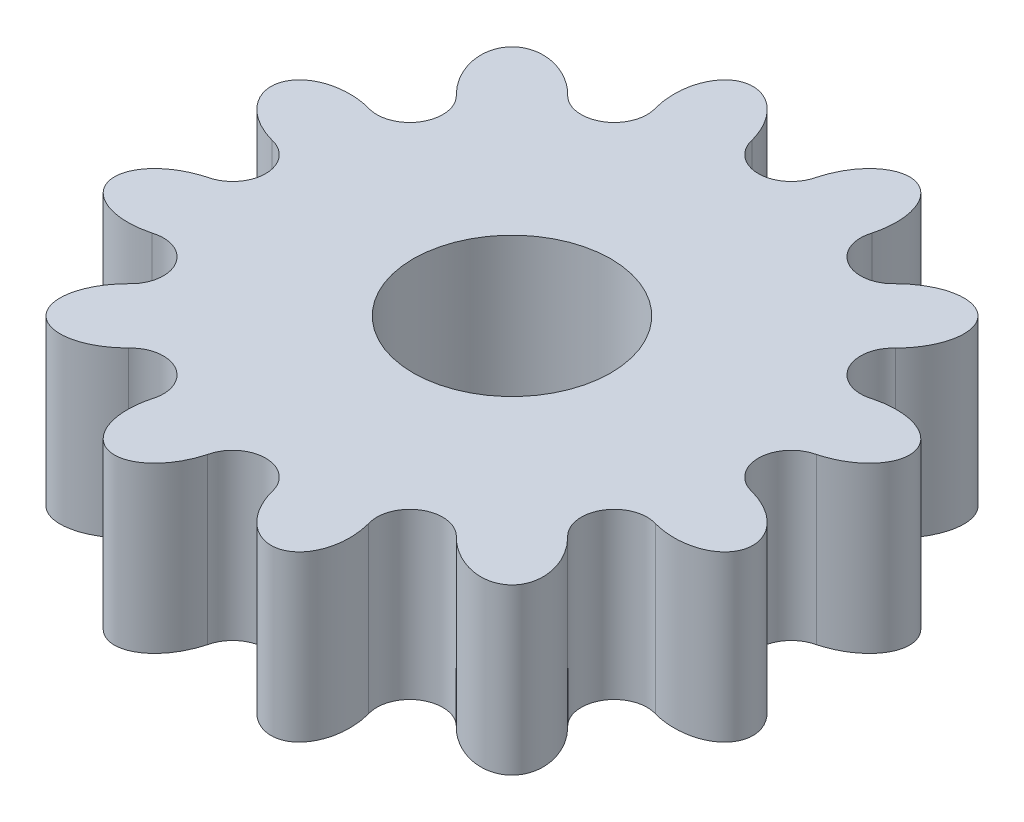
from build123d import *

# Parameters (mm, degrees)
BOSS_EXTRUDE2_DEPTH = 5
SKETCH4_R           = 6
CUT_EXTRUDE3_DEPTH  = 10
CUT_EXTRUDE4_DEPTH  = 10
CIRPATTERN1_COUNT   = 12


with BuildPart() as part:
    # Sketch2 → Boss-Extrude2 (new, symmetric)
    with BuildSketch(Plane(origin=(0, 0, 0), x_dir=(1, 0, 0), z_dir=(0, 1, 0))):
        with BuildLine():
            Line((1.952478146, 16.518952502), (2.684980769, 19.818952502))
            ThreePointArc((2.684980769, 19.818952502), (5.176380902, 19.318516526), (7.584214696, 18.506206728))
            Line((7.584214696, 18.506206728), (6.568580576, 15.282071584))
            ThreePointArc((6.568580576, 15.282071584), (7.476172518, 12.949110648), (9.950371926, 13.329593437))
            Line((9.950371926, 13.329593437), (12.234737806, 15.821225958))
            ThreePointArc((12.234737806, 15.821225958), (14.142135624, 14.142135624), (15.821225958, 12.234737806))
            Line((15.821225958, 12.234737806), (13.329593437, 9.950371926))
            ThreePointArc((13.329593437, 9.950371926), (12.949110648, 7.476172518), (15.282071584, 6.568580576))
            Line((15.282071584, 6.568580576), (18.506206728, 7.584214696))
            ThreePointArc((18.506206728, 7.584214696), (19.318516526, 5.176380902), (19.818952502, 2.684980769))
            Line((19.818952502, 2.684980769), (16.518952502, 1.952478146))
            ThreePointArc((16.518952502, 1.952478146), (14.952345036, 0), (16.518952502, -1.952478146))
            Line((16.518952502, -1.952478146), (19.818952502, -2.684980769))
            ThreePointArc((19.818952502, -2.684980769), (19.318516526, -5.176380902), (18.506206728, -7.584214696))
            Line((18.506206728, -7.584214696), (15.282071584, -6.568580576))
            ThreePointArc((15.282071584, -6.568580576), (12.949110648, -7.476172518), (13.329593437, -9.950371926))
            Line((13.329593437, -9.950371926), (15.821225958, -12.234737806))
            ThreePointArc((15.821225958, -12.234737806), (14.142135624, -14.142135624), (12.234737806, -15.821225958))
            Line((12.234737806, -15.821225958), (9.950371926, -13.329593437))
            ThreePointArc((9.950371926, -13.329593437), (7.476172518, -12.949110648), (6.568580576, -15.282071584))
            Line((6.568580576, -15.282071584), (7.584214696, -18.506206728))
            ThreePointArc((7.584214696, -18.506206728), (5.176380902, -19.318516526), (2.684980769, -19.818952502))
            Line((2.684980769, -19.818952502), (1.952478146, -16.518952502))
            ThreePointArc((1.952478146, -16.518952502), (0, -14.952345036), (-1.952478146, -16.518952502))
            Line((-1.952478146, -16.518952502), (-2.684980769, -19.818952502))
            ThreePointArc((-2.684980769, -19.818952502), (-5.176380902, -19.318516526), (-7.584214696, -18.506206728))
            Line((-7.584214696, -18.506206728), (-6.568580576, -15.282071584))
            ThreePointArc((-6.568580576, -15.282071584), (-7.476172518, -12.949110648), (-9.950371926, -13.329593437))
            Line((-9.950371926, -13.329593437), (-12.234737806, -15.821225958))
            ThreePointArc((-12.234737806, -15.821225958), (-14.142135624, -14.142135624), (-15.821225958, -12.234737806))
            Line((-15.821225958, -12.234737806), (-13.329593437, -9.950371926))
            ThreePointArc((-13.329593437, -9.950371926), (-12.949110648, -7.476172518), (-15.282071584, -6.568580576))
            Line((-15.282071584, -6.568580576), (-18.506206728, -7.584214696))
            ThreePointArc((-18.506206728, -7.584214696), (-19.318516526, -5.176380902), (-19.818952502, -2.684980769))
            Line((-19.818952502, -2.684980769), (-16.518952502, -1.952478146))
            ThreePointArc((-16.518952502, -1.952478146), (-14.952345036, 0), (-16.518952502, 1.952478146))
            Line((-16.518952502, 1.952478146), (-19.818952502, 2.684980769))
            ThreePointArc((-19.818952502, 2.684980769), (-19.318516526, 5.176380902), (-18.506206728, 7.584214696))
            Line((-18.506206728, 7.584214696), (-15.282071584, 6.568580576))
            ThreePointArc((-15.282071584, 6.568580576), (-12.949110648, 7.476172518), (-13.329593437, 9.950371926))
            Line((-13.329593437, 9.950371926), (-15.821225958, 12.234737806))
            ThreePointArc((-15.821225958, 12.234737806), (-14.142135624, 14.142135624), (-12.234737806, 15.821225958))
            Line((-12.234737806, 15.821225958), (-9.950371926, 13.329593437))
            ThreePointArc((-9.950371926, 13.329593437), (-7.476172518, 12.949110648), (-6.568580576, 15.282071584))
            Line((-6.568580576, 15.282071584), (-7.584214696, 18.506206728))
            ThreePointArc((-7.584214696, 18.506206728), (-5.176380902, 19.318516526), (-2.684980769, 19.818952502))
            Line((-2.684980769, 19.818952502), (-1.952478146, 16.518952502))
            ThreePointArc((-1.952478146, 16.518952502), (0, 14.952345036), (1.952478146, 16.518952502))
        make_face()
    extrude(amount=BOSS_EXTRUDE2_DEPTH, both=True)

    # Sketch4 → Cut-Extrude3 (cut)
    with BuildSketch(Plane(origin=(0, 5, 0), x_dir=(1, 0, 0), z_dir=(0, 1, 0))):
        with Locations(Location((0, 0, 0), (0, 0, 270))):
            Circle(SKETCH4_R)
    extrude(amount=-CUT_EXTRUDE3_DEPTH, mode=Mode.SUBTRACT)

    # Sketch5 → Cut-Extrude4 (cut)
    with BuildSketch(Plane(origin=(0, 5, 0), x_dir=(1, 0, 0), z_dir=(0, 1, 0))):
        with BuildLine():
            ThreePointArc((6.568580576, 15.282071584), (5.841490769, 21.80074034), (1.952478146, 16.518952502))
            add(Edge.make_bspline(
                [(6.568580576, 15.282071584), (7.484432117, 18.700076067), (5.176380902, 19.318516526), (2.868329687, 19.936956985), (1.952478146, 16.518952502)],
                knots=[1.570796327, 1.570796327, 1.570796327, 3.141592654, 3.141592654, 4.71238898, 4.71238898, 4.71238898], degree=2, weights=[1, 0.707106781, 1, 0.707106781, 1]))
        make_face()
    cut_extrude4 = extrude(amount=-CUT_EXTRUDE4_DEPTH, mode=Mode.SUBTRACT)

    # CirPattern1: Cut-Extrude4 ×12 about axis
    cirpattern1_axis = Axis((0, 5, 0), (0, 1, 0))
    for i in range(1, CIRPATTERN1_COUNT):
        add(cut_extrude4.rotate(cirpattern1_axis, i * 360 / CIRPATTERN1_COUNT), mode=Mode.SUBTRACT)


solid = part.part
